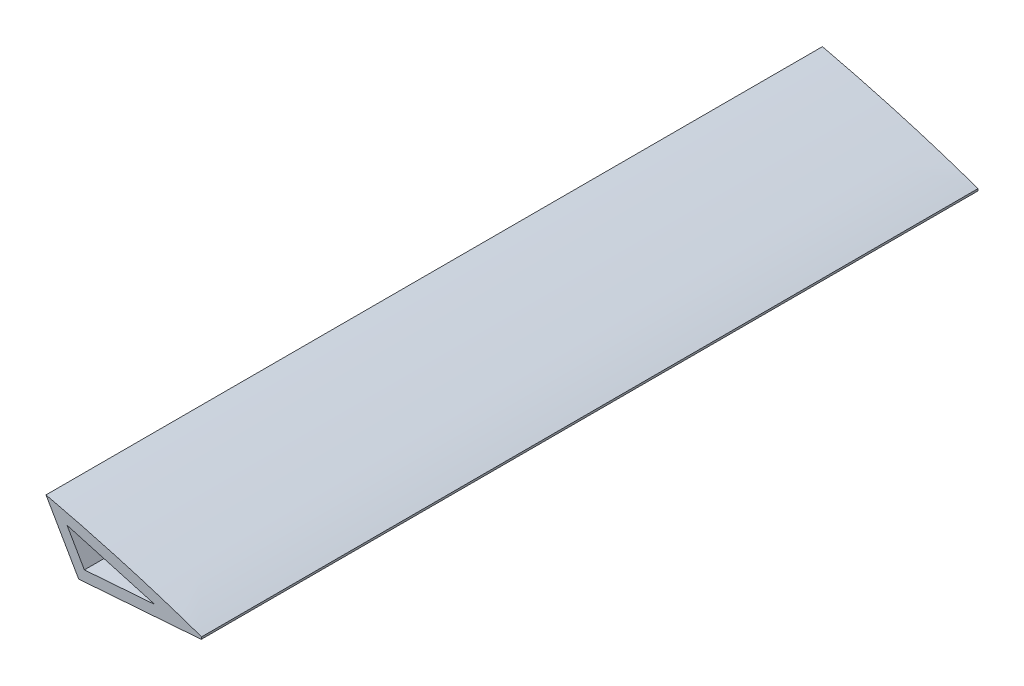
from build123d import *

# Parameters (mm, degrees)
BOSS_EXTRUDE1_DEPTH = 375


with BuildPart() as part:
    # Master sketch-Wing Geometry Master Sketc → Boss-Extrude1 (new body)
    with BuildSketch(Plane.XY):
        with BuildLine():
            Line((299.93, -0.56), (300.07, 0.56))
            add(Edge.make_bspline(
                [(300.07, 0.56), (300.046727211, 0.570149465), (299.951918411, 0.611496405), (299.73145109, 0.687910176), (299.360701306, 0.80207776), (298.851143071, 0.99004976), (298.192762058, 1.214989557), (297.390581316, 1.498347711), (296.440162644, 1.827131445), (295.347552696, 2.205915898), (294.109915848, 2.626416664), (292.734867315, 3.097875543), (291.212205014, 3.603301609), (289.556778296, 4.170360104), (287.754541524, 4.750229424), (285.826587723, 5.399922294), (283.756363975, 6.062421055), (281.558560221, 6.775887077), (279.22562543, 7.517307408), (276.759052146, 8.280298176), (274.172767845, 9.09557711), (271.459553567, 9.926240206), (268.620233525, 10.77076618), (265.667031068, 11.655929728), (262.589976024, 12.539934752), (259.406507793, 13.464429613), (256.106091201, 14.393267862), (252.694259979, 15.330032696), (249.183398904, 16.29260897), (245.565461503, 17.251434656), (241.852861879, 18.22108263), (238.042855476, 19.19138103), (234.140998952, 20.15735732), (230.154027103, 21.143304457), (227.071354515, 21.873459433), (225.320067796, 22.282419133), (224.93, 22.373189537)],
                knots=[0, 0, 0, 0, 0.000121802, 0.000496198, 0.001118298, 0.001983272, 0.003101095, 0.004456671, 0.0060651, 0.00792639, 0.010005101, 0.012336683, 0.014900868, 0.017702772, 0.020732285, 0.023984296, 0.027464026, 0.031161268, 0.035071154, 0.039209025, 0.043549161, 0.048082096, 0.052823294, 0.05776212, 0.062874254, 0.068184085, 0.073667486, 0.07932465, 0.085159937, 0.091134213, 0.09728269, 0.103570554, 0.109998008, 0.116569035, 0.123276218, 0.125197771, 0.125197771, 0.125197771, 0.125197771], degree=3))
            Line((224.93, 22.373189537), (240.711180377, -4.960616679))
            add(Edge.make_bspline(
                [(240.711180377, -4.960616679), (241.664163028, -4.887637656), (243.840258172, -4.718440324), (247.20981219, -4.46085993), (250.787106765, -4.195760616), (254.266072169, -3.918835614), (257.64325016, -3.672183933), (260.913793207, -3.436175985), (264.072684975, -3.187909636), (267.117194027, -2.977146375), (270.04316125, -2.751013416), (272.846765874, -2.544700113), (275.529429199, -2.33878816), (278.087148077, -2.166666674), (280.513268395, -1.982425314), (282.806745266, -1.814435769), (284.962823137, -1.649552143), (286.983837234, -1.517010694), (288.863257365, -1.37227381), (290.600165156, -1.245587565), (292.192790163, -1.119159502), (293.640594786, -1.028164187), (294.939565333, -0.920704317), (296.089960301, -0.842870725), (297.090587221, -0.777681987), (297.939585238, -0.701301857), (298.63665195, -0.653077401), (299.177018782, -0.618208827), (299.562595702, -0.575799674), (299.797349193, -0.578243239), (299.903360171, -0.56366373), (299.93, -0.56)],
                knots=[0.905027219, 0.905027219, 0.905027219, 0.905027219, 0.909613035, 0.915499668, 0.921241563, 0.92682399, 0.932244523, 0.93748843, 0.942556897, 0.947447555, 0.952130861, 0.956637537, 0.960935685, 0.965040102, 0.968937144, 0.972609709, 0.976073746, 0.979312161, 0.982327244, 0.985117851, 0.987668032, 0.989992582, 0.992077865, 0.99392155, 0.995524803, 0.996888844, 0.998011233, 0.998877243, 0.999486883, 0.999871057, 1, 1, 1, 1], degree=3))
        make_face()
        Polygon((277.5184867, 2.809088635), (243.466590848, 0.266872389), (235.093272506, 14.769885184), align=None, mode=Mode.SUBTRACT)
    extrude(amount=BOSS_EXTRUDE1_DEPTH)


solid = part.part
